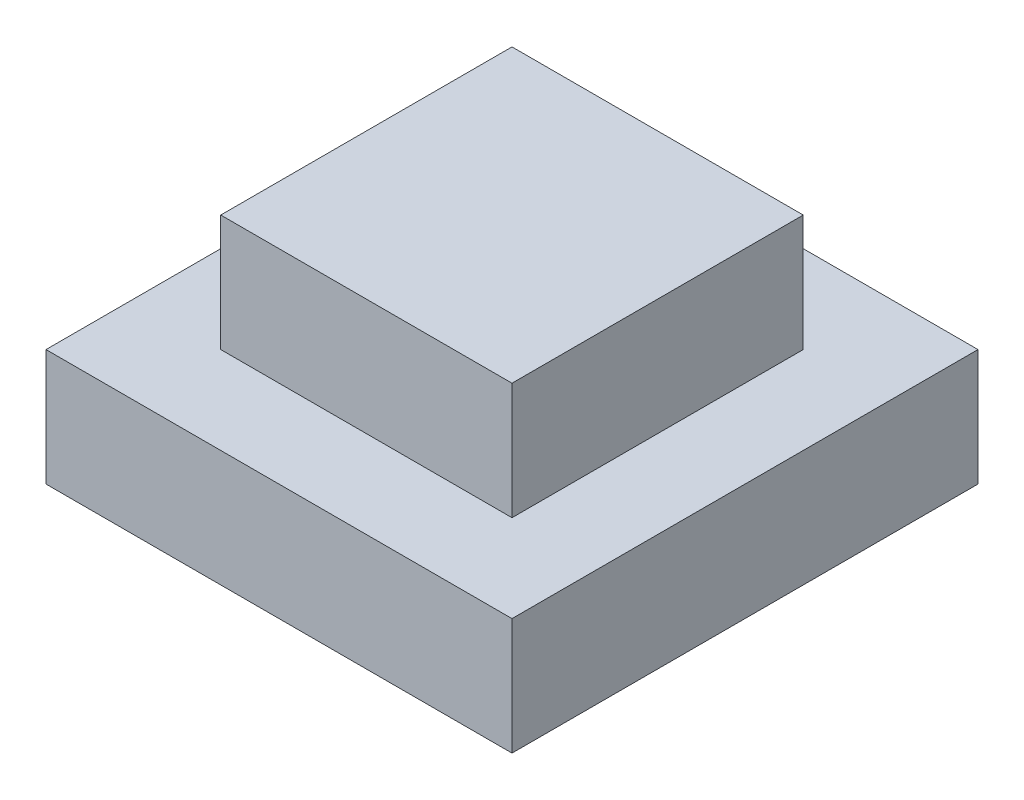
from build123d import *

# Parameters (mm, degrees)
ESQUISSE1_W        = 8
ESQUISSE1_H        = 8
BOSS_EXTRU_1_DEPTH = 3
CHANFREIN1_SIZE    = 1
ESQUISSE2_W        = 5
ESQUISSE2_H        = 5
BOSS_EXTRU_2_DEPTH = 2


with BuildPart() as part:
    # Esquisse1 → Boss.-Extru.1 (new body)
    with BuildSketch(Plane(origin=(0, 0, 0), x_dir=(1, 0, 0), z_dir=(0, 1, 0))):
        Rectangle(ESQUISSE1_W, ESQUISSE1_H)
    extrude(amount=BOSS_EXTRU_1_DEPTH)

    # Chanfrein1
    chanfrein1_edges = [part.edges().sort_by_distance(p)[0] for p in [
        (0, 0, 4),
        (-4, 0, 0),
        (0, 0, -4),
        (4, 0, 0),
    ]]
    chamfer(chanfrein1_edges, length=CHANFREIN1_SIZE)

    # Esquisse2 → Boss.-Extru.2 (add)
    with BuildSketch(Plane(origin=(0, 3, 0), x_dir=(1, 0, 0), z_dir=(0, 1, 0))):
        Rectangle(ESQUISSE2_W, ESQUISSE2_H)
    extrude(amount=BOSS_EXTRU_2_DEPTH)


solid = part.part
